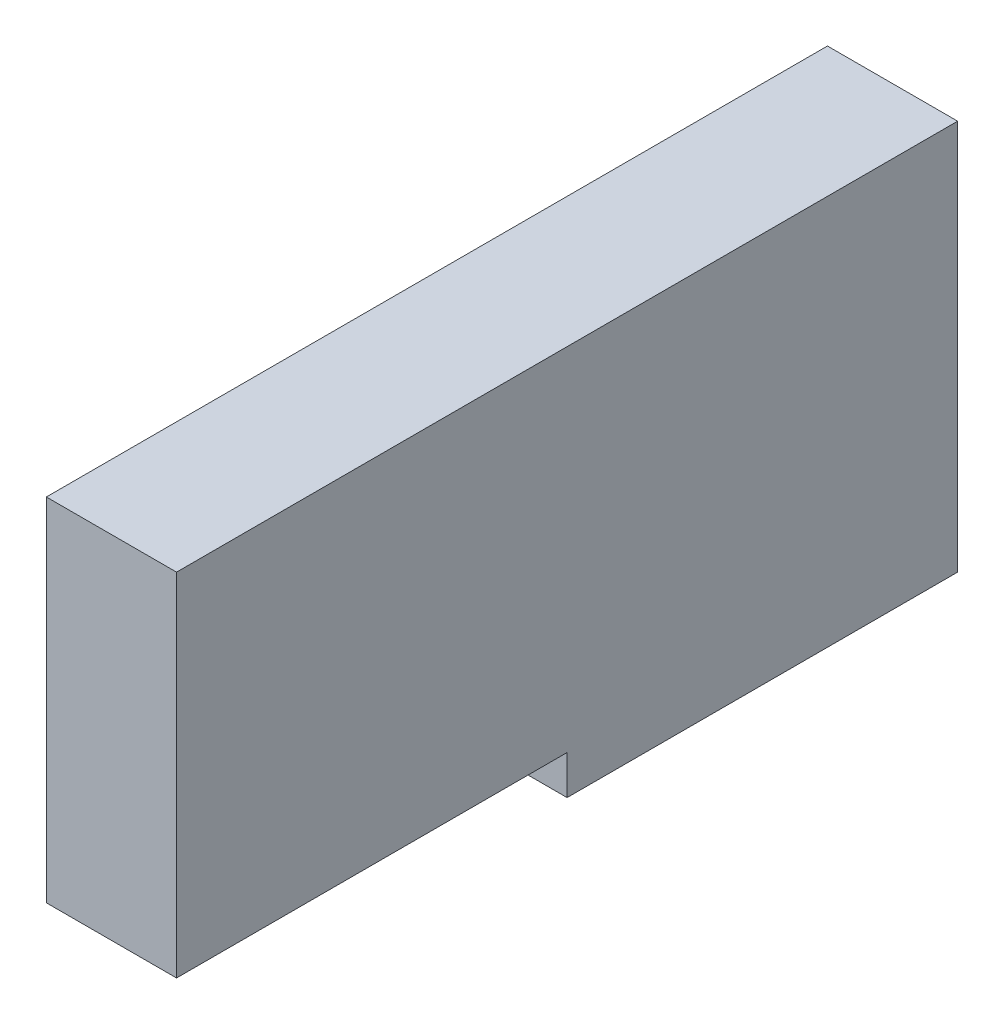
from build123d import *

# Parameters (mm, degrees)
ESQUISSE1_W             = 10
ESQUISSE1_H             = 30
ESQUISSE1_R             = 1.75
BOSS_EXTRU_1_DEPTH      = 20
ESQUISSE2_W             = 10
ESQUISSE2_H             = 30
BOSS_EXTRU_2_DEPTH      = 10
ESQUISSE3_W             = 10
ESQUISSE3_H             = 27
BOSS_EXTRU_3_DEPTH      = 30
ESQUISSE4_R             = 1.75
ENL_V_MAT_EXTRU_1_DEPTH = 15


with BuildPart() as part:
    # Esquisse1 → Boss.-Extru.1 (new body)
    with BuildSketch(Plane.XY):
        with Locations((5, 15)):
            Rectangle(ESQUISSE1_W, ESQUISSE1_H)
        with Locations((5, 5)):
            Circle(ESQUISSE1_R, mode=Mode.SUBTRACT)
        with Locations((5, 15)):
            Circle(ESQUISSE1_R, mode=Mode.SUBTRACT)
        with Locations((5, 25)):
            Circle(ESQUISSE1_R, mode=Mode.SUBTRACT)
    extrude(amount=BOSS_EXTRU_1_DEPTH)

    # Esquisse2 → Boss.-Extru.2 (add)
    with BuildSketch(Plane.XY.offset(20)):
        with Locations((5, 15)):
            Rectangle(ESQUISSE2_W, ESQUISSE2_H)
    extrude(amount=BOSS_EXTRU_2_DEPTH)

    # Esquisse3 → Boss.-Extru.3 (add)
    with BuildSketch(Plane.XY.offset(30)):
        with Locations((5, 16.5)):
            Rectangle(ESQUISSE3_W, ESQUISSE3_H)
    extrude(amount=BOSS_EXTRU_3_DEPTH)

    # Esquisse4 → Enlèv. mat.-Extru.1 (cut)
    with BuildSketch(Plane(origin=(0, 3, 0), x_dir=(-1, 0, 0), z_dir=(0, -1, 0))):
        with Locations(Location((-5, -55, 0), (0, 0, 180))):
            Circle(ESQUISSE4_R)
        with Locations(Location((-5, -45, 0), (0, 0, 180))):
            Circle(ESQUISSE4_R)
        with Locations(Location((-5, -35, 0), (0, 0, 180))):
            Circle(ESQUISSE4_R)
    extrude(amount=-ENL_V_MAT_EXTRU_1_DEPTH, mode=Mode.SUBTRACT)


solid = part.part
